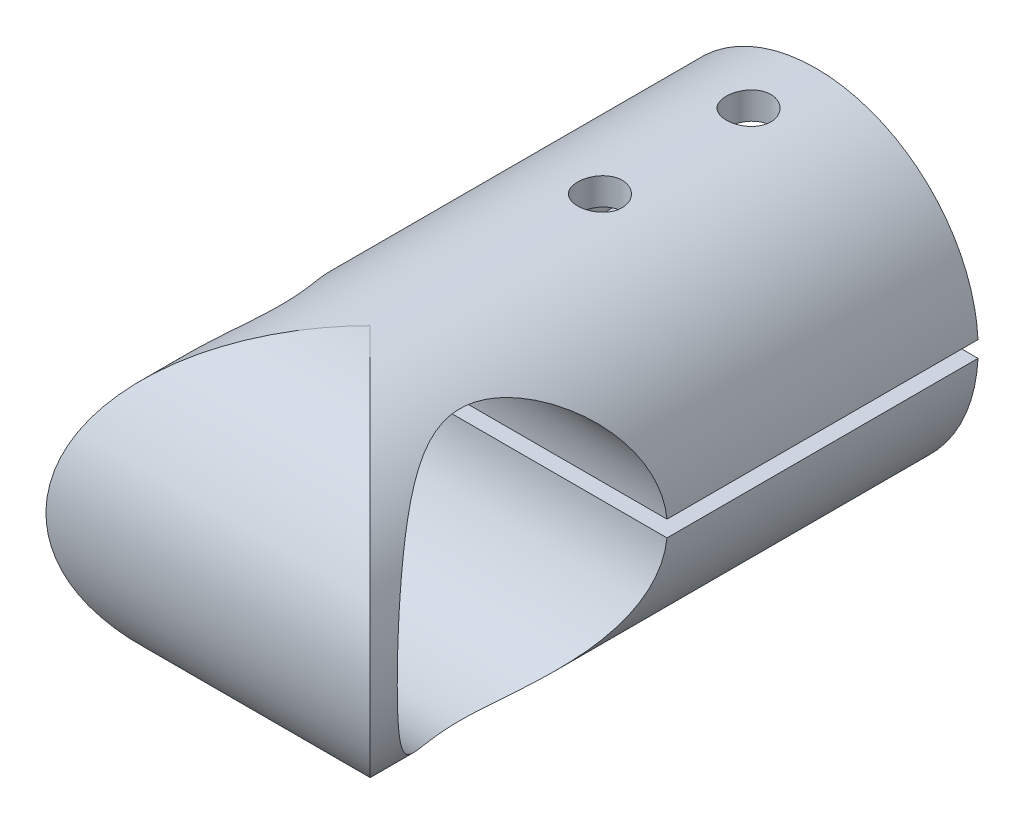
from build123d import *

# Parameters (mm, degrees)
ESQUISSE1_R                  = 12
ESQUISSE1_R_2                = 10
BOSS_EXTRU_1_DEPTH           = 21
ESQUISSE2_R                  = 12
BOSS_EXTRU_2_DEPTH           = 24
ENL_V_MAT_EXTRU_1_DEPTH      = 49.093658626
ENL_V_MAT_EXTRU_1_DEPTH_BACK = 49.093658626
ENL_V_MAT_EXTRU_2_DEPTH      = 49.246865329
ENL_V_MAT_EXTRU_2_DEPTH_BACK = 49.246865329
ESQUISSE4_R                  = 1.65


with BuildPart() as part:
    # Esquisse1 → Boss.-Extru.1 (new body)
    with BuildSketch(Plane.XY):
        with Locations(Location((0, 0, 0), (0, 0, 180))):
            Circle(ESQUISSE1_R)
        with Locations(Location((0, 0, 0), (0, 0, 180))):
            Circle(ESQUISSE1_R_2, mode=Mode.SUBTRACT)
    extrude(amount=BOSS_EXTRU_1_DEPTH)

    # Esquisse2 → Boss.-Extru.2 (add)
    with BuildSketch(Plane.XY.offset(21)):
        with Locations(Location((0, 0, 0), (0, 0, 180))):
            Circle(ESQUISSE2_R)
    extrude(amount=BOSS_EXTRU_2_DEPTH)

    # Esquisse3 → Enlèv. mat.-Extru.1 (cut, two sides: drawn at the far end of the back side and taken through both)
    with BuildSketch(Plane(origin=(0, 0, 0), x_dir=(0, 0, -1), z_dir=(1, 0, 0)).offset(-ENL_V_MAT_EXTRU_1_DEPTH_BACK)):
        with BuildLine():
            Line((-33, 12), (-45, 12))
            Line((-45, 12), (-50, 0))
            Line((-50, 0), (-45, -12))
            Line((-45, -12), (-33, -12))
            ThreePointArc((-33, -12), (-45, 0), (-33, 12))
        make_face()
        with BuildLine():
            Line((-23.018016229, 0.6), (0, 0.6))
            Line((0, 0.6), (0, -0.6))
            Line((0, -0.6), (-23.018016229, -0.6))
            ThreePointArc((-23.018016229, -0.6), (-43, 0), (-23.018016229, 0.6))
        make_face()
    extrude(amount=ENL_V_MAT_EXTRU_1_DEPTH + ENL_V_MAT_EXTRU_1_DEPTH_BACK, mode=Mode.SUBTRACT)

    # Esquisse4 → Enlèv. mat.-Extru.2 (cut, two sides: drawn at the far end of the back side and taken through both)
    with BuildSketch(Plane(origin=(0, -0.6, 0), x_dir=(1, 0, 0), z_dir=(0, 1, 0)).offset(-ENL_V_MAT_EXTRU_2_DEPTH_BACK)):
        with Locations(Location((0, -16, 0), (0, 0, 270))):
            Circle(ESQUISSE4_R)
        with Locations(Location((0, -5, 0), (0, 0, 270))):
            Circle(ESQUISSE4_R)
    extrude(amount=ENL_V_MAT_EXTRU_2_DEPTH + ENL_V_MAT_EXTRU_2_DEPTH_BACK, mode=Mode.SUBTRACT)


solid = part.part
